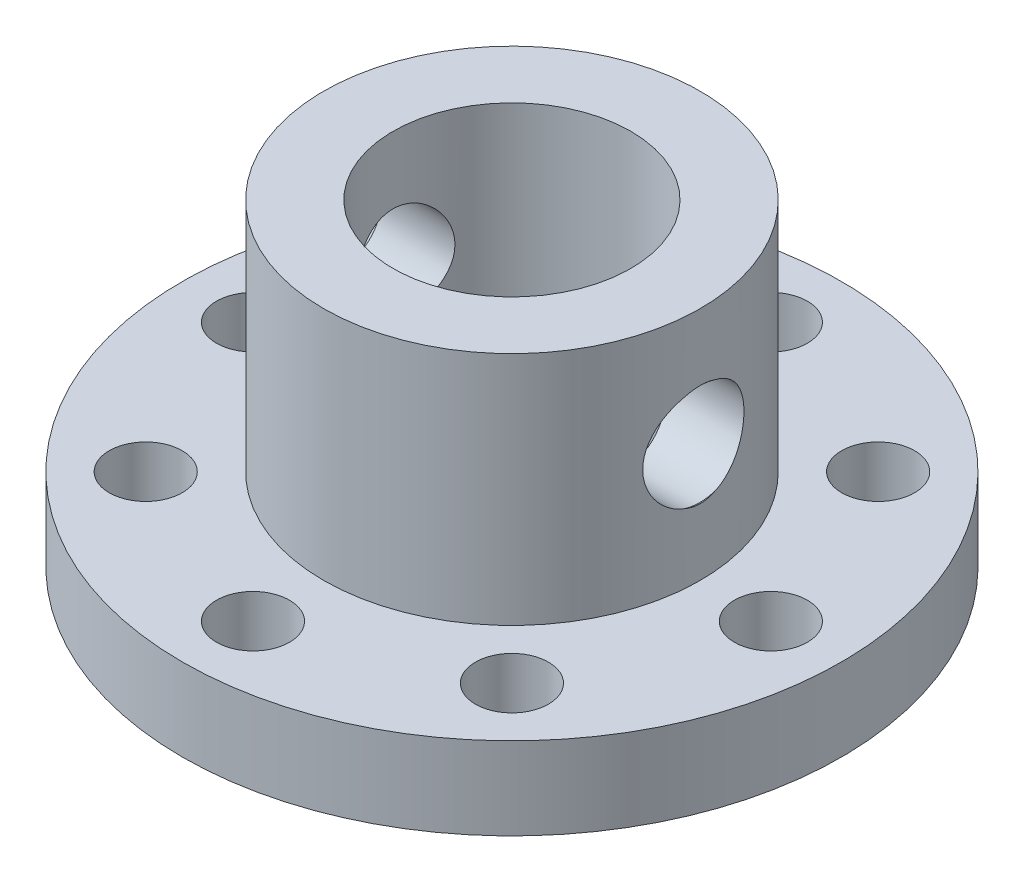
from build123d import *

# Parameters (mm, degrees)
SKETCH1_R                      = 14
BOSS_EXTRUDE1_DEPTH            = 1.75
M2_5_CLEARANCE_HOLE1_D         = 3.1
M2_5_CLEARANCE_HOLE1_DEPTH     = 6
M2_5_CLEARANCE_HOLE1_TIP       = 0.931333959
SKETCH9_R                      = 8
BOSS_EXTRUDE2_DEPTH            = 10
SKETCH7_R                      = 5.05
CUT_EXTRUDE1_DEPTH             = 24.963513933
M4_CLEARANCE_HOLE1_D           = 4.3
M4_CLEARANCE_HOLE1_DEPTH       = 25.4
M4_CLEARANCE_HOLE1_CSINK_D     = 4.35
M4_CLEARANCE_HOLE1_CSINK_ANGLE = 90
M4_CLEARANCE_HOLE1_TIP         = 1.291850331


with BuildPart() as part:
    # Sketch1 → Boss-Extrude1 (new, symmetric)
    with BuildSketch(Plane(origin=(0, 0, 0), x_dir=(1, 0, 0), z_dir=(0, 1, 0))):
        with Locations(Location((0, 0, 0), (0, 0, 270))):
            Circle(SKETCH1_R)
    extrude(amount=BOSS_EXTRUDE1_DEPTH, both=True)

    # M2.5 Clearance Hole1
    with Locations(Plane(origin=(0, 1.75, 0), x_dir=(1, 0, 0), z_dir=(0, 1, 0))):
        with Locations((-11, 0), (-7.778174593, 7.778174593), (0, 11), (7.778174593, 7.778174593), (11, 0), (7.778174593, -7.778174593), (0, -11), (-7.778174593, -7.778174593)):
            Hole(M2_5_CLEARANCE_HOLE1_D / 2, depth=M2_5_CLEARANCE_HOLE1_DEPTH)
            with Locations((0, 0, -(M2_5_CLEARANCE_HOLE1_DEPTH + M2_5_CLEARANCE_HOLE1_TIP / 2))):  # 118° drill point
                Cone(0, M2_5_CLEARANCE_HOLE1_D / 2, M2_5_CLEARANCE_HOLE1_TIP, mode=Mode.SUBTRACT)

    # Sketch9 → Boss-Extrude2 (add)
    with BuildSketch(Plane(origin=(0, 1.75, 0), x_dir=(1, 0, 0), z_dir=(0, 1, 0))):
        with Locations(Location((0, 0, 0), (0, 0, 270))):
            Circle(SKETCH9_R)
    extrude(amount=BOSS_EXTRUDE2_DEPTH)

    # Sketch7 → Cut-Extrude1 (cut, through all)
    with BuildSketch(Plane.XZ.offset(1.75)):
        with Locations(Location((0, 0, 0), (0, 0, 270))):
            Circle(SKETCH7_R)
    extrude(amount=-CUT_EXTRUDE1_DEPTH, mode=Mode.SUBTRACT)

    # M4 Clearance Hole1
    with Locations(Plane(origin=(8, 0, 0), x_dir=(0, 0, -1), z_dir=(1, 0, 0))):
        with Locations((0, 6.75)):
            CounterSinkHole(M4_CLEARANCE_HOLE1_D / 2, M4_CLEARANCE_HOLE1_CSINK_D / 2, depth=M4_CLEARANCE_HOLE1_DEPTH, counter_sink_angle=M4_CLEARANCE_HOLE1_CSINK_ANGLE)
            with Locations((0, 0, -(M4_CLEARANCE_HOLE1_DEPTH + M4_CLEARANCE_HOLE1_TIP / 2))):  # 118° drill point
                Cone(0, M4_CLEARANCE_HOLE1_D / 2, M4_CLEARANCE_HOLE1_TIP, mode=Mode.SUBTRACT)


solid = part.part
